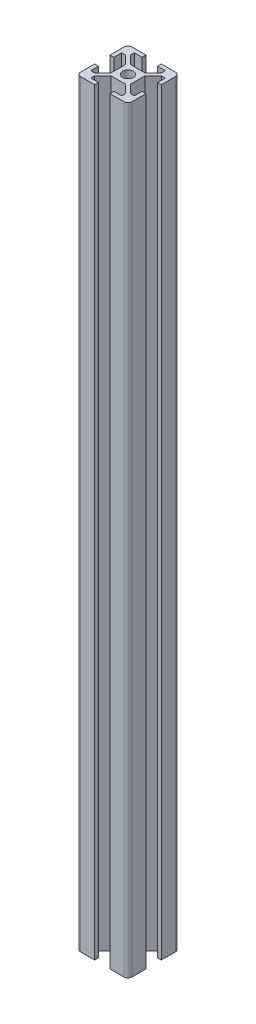
from build123d import *

# Parameters (mm, degrees)
BOSS_EXTRUDE1_DEPTH     = 147.6375
CUT_EXTRUDE1_DEPTH      = 149.31328803
CUT_EXTRUDE1_DEPTH_BACK = 149.31328803
SKETCH3_R               = 2.1
CUT_EXTRUDE2_DEPTH      = 13
CUT_EXTRUDE3_START      = -13
SKETCH4_R               = 2.1
CUT_EXTRUDE3_DEPTH      = 13


with BuildPart() as part:
    # Sketch1 → Boss-Extrude1 (new, symmetric)
    with BuildSketch(Plane(origin=(0, 0, 0), x_dir=(1, 0, 0), z_dir=(0, 1, 0))):
        with BuildLine():
            Line((-8.5, -10), (8.5, -10))
            ThreePointArc((8.5, -10), (9.560660172, -9.560660172), (10, -8.5))
            Line((10, -8.5), (10, 8.5))
            ThreePointArc((10, 8.5), (9.560660172, 9.560660172), (8.5, 10))
            Line((8.5, 10), (-8.5, 10))
            ThreePointArc((-8.5, 10), (-9.560660172, 9.560660172), (-10, 8.5))
            Line((-10, 8.5), (-10, -8.5))
            ThreePointArc((-10, -8.5), (-9.560660172, -9.560660172), (-8.5, -10))
        make_face()
    extrude(amount=BOSS_EXTRUDE1_DEPTH, both=True)

    # Sketch2 → Cut-Extrude1 (cut, two sides: drawn at the far end of the back side and taken through both)
    with BuildSketch(Plane(origin=(0, 0, 0), x_dir=(1, 0, 0), z_dir=(0, 1, 0)).offset(-CUT_EXTRUDE1_DEPTH_BACK)):
        Polygon((-3, 10), (3, 10), (3, 8.5), (6, 8.5), (6, 7.060660172), (2.739339828, 3.8), (-2.739339828, 3.8), (-6, 7.060660172), (-6, 8.5), (-3, 8.5), align=None)
        Polygon((8.5, -3), (8.5, -6), (7.060660172, -6), (3.8, -2.739339828), (3.8, 2.739339828), (7.060660172, 6), (8.5, 6), (8.5, 3), (10, 3), (10, -3), align=None)
        Polygon((-3, -8.5), (-6, -8.5), (-6, -7.060660172), (-2.739339828, -3.8), (2.739339828, -3.8), (6, -7.060660172), (6, -8.5), (3, -8.5), (3, -10), (-3, -10), align=None)
        Polygon((-8.5, 3), (-8.5, 6), (-7.060660172, 6), (-3.8, 2.739339828), (-3.8, -2.739339828), (-7.060660172, -6), (-8.5, -6), (-8.5, -3), (-10, -3), (-10, 3), align=None)
    extrude(amount=CUT_EXTRUDE1_DEPTH + CUT_EXTRUDE1_DEPTH_BACK, mode=Mode.SUBTRACT)

    # Sketch3 → Cut-Extrude2 (cut)
    with BuildSketch(Plane(origin=(0, 147.6375, 0), x_dir=(1, 0, 0), z_dir=(0, 1, 0))):
        with Locations(Location((0, 0, 0), (0, 0, 270))):
            Circle(SKETCH3_R)
    extrude(amount=-CUT_EXTRUDE2_DEPTH, mode=Mode.SUBTRACT)

    # Sketch4 → Cut-Extrude3 (cut)
    with BuildSketch(Plane.XZ.offset(147.6375).offset(CUT_EXTRUDE3_START)):
        with Locations(Location((0, 0, 0), (0, 0, 90))):
            Circle(SKETCH4_R)
    extrude(amount=CUT_EXTRUDE3_DEPTH, mode=Mode.SUBTRACT)


solid = part.part
